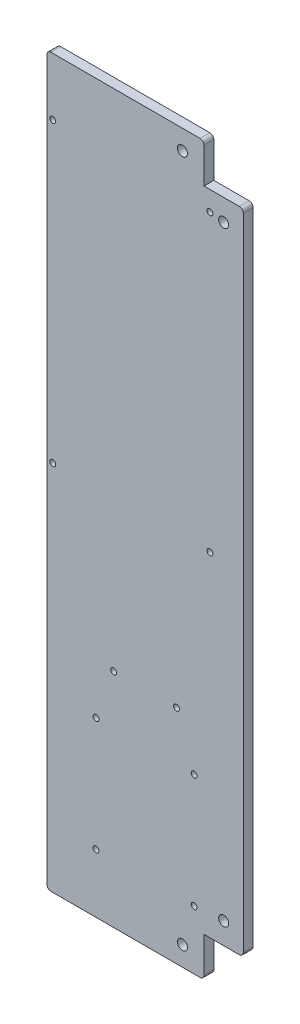
from build123d import *

# Parameters (mm, degrees)
SKETCH_2_W          = 100
SKETCH_2_H          = 370
EXTRUDE_1_DEPTH     = 2.5
SKETCH_5_R          = 1.5
CUT_EXTRUDE_3_DEPTH = 192.702895127
SKETCH_6_R          = 1.5
CUT_EXTRUDE_4_DEPTH = 192.702895127
SKETCH_7_W          = 20
SKETCH_7_H          = 20
CUT_EXTRUDE_5_DEPTH = 192.702895127
SKETCH_8_R          = 2.55
CUT_EXTRUDE_6_DEPTH = 192.702895127
FILLET_1_R          = 2
SKETCH_10_R         = 1.5
CUT_EXTRUDE_7_DEPTH = 13


with BuildPart() as part:
    # 草图2 → 凸台-拉伸1 (new, symmetric)
    with BuildSketch(Plane.XY):
        Rectangle(SKETCH_2_W, SKETCH_2_H)
    extrude(amount=EXTRUDE_1_DEPTH, both=True)

    # 草图5 → 切除-拉伸3 (cut, through all)
    with BuildSketch(Plane.XY.offset(2.5)):
        with Locations((33, 155)):
            Circle(SKETCH_5_R)
        with Locations(Location((-47, 155.654762379, 0), (0, 0, 180))):
            Circle(SKETCH_5_R)
        with Locations(Location((33, 5, 0), (0, 0, 180))):
            Circle(SKETCH_5_R)
        with Locations((-47, 4.345237621)):
            Circle(SKETCH_5_R)
    extrude(amount=-CUT_EXTRUDE_3_DEPTH, mode=Mode.SUBTRACT)

    # 草图6 → 切除-拉伸4 (cut, through all)
    with BuildSketch(Plane.XY.offset(2.5)):
        with Locations((25, -155)):
            Circle(SKETCH_6_R)
        with Locations(Location((-25, -155, 0), (0, 0, 180))):
            Circle(SKETCH_6_R)
        with Locations(Location((25, -97, 0), (0, 0, 180))):
            Circle(SKETCH_6_R)
        with Locations((-25, -97)):
            Circle(SKETCH_6_R)
    extrude(amount=-CUT_EXTRUDE_4_DEPTH, mode=Mode.SUBTRACT)

    # 草图7 → 切除-拉伸5 (cut, through all)
    with BuildSketch(Plane.XY.offset(2.5)):
        with Locations((40, 175)):
            Rectangle(SKETCH_7_W, SKETCH_7_H)
        with Locations((40, -175)):
            Rectangle(SKETCH_7_W, SKETCH_7_H)
    extrude(amount=-CUT_EXTRUDE_5_DEPTH, mode=Mode.SUBTRACT)

    # 草图8 → 切除-拉伸6 (cut, through all)
    with BuildSketch(Plane(origin=(0, 0, -2.5), x_dir=(-1, 0, 0), z_dir=(0, 0, -1))):
        with Locations((-19, 175)):
            Circle(SKETCH_8_R)
        with Locations((-40, 154)):
            Circle(SKETCH_8_R)
        with Locations((-40, -154)):
            Circle(SKETCH_8_R)
        with Locations((-19, -175)):
            Circle(SKETCH_8_R)
    extrude(amount=-CUT_EXTRUDE_6_DEPTH, mode=Mode.SUBTRACT)

    # 圆角1
    fillet_1_edges = [part.edges().sort_by_distance(p)[0] for p in [
        (50, 165, 0),
        (30, 185, 0),
        (30, -185, 0),
        (50, -165, 0),
        (-50, 185, 0),
        (-50, -185, 0),
    ]]
    fillet(fillet_1_edges, radius=FILLET_1_R)

    # 草图10 → 切除-拉伸7 (cut)
    with BuildSketch(Plane(origin=(0, 0, -2.5), x_dir=(-1, 0, 0), z_dir=(0, 0, -1))):
        with Locations((-16, -72)):
            Circle(SKETCH_10_R)
        with Locations((16, -72)):
            Circle(SKETCH_10_R)
    extrude(amount=-CUT_EXTRUDE_7_DEPTH, mode=Mode.SUBTRACT)


solid = part.part
